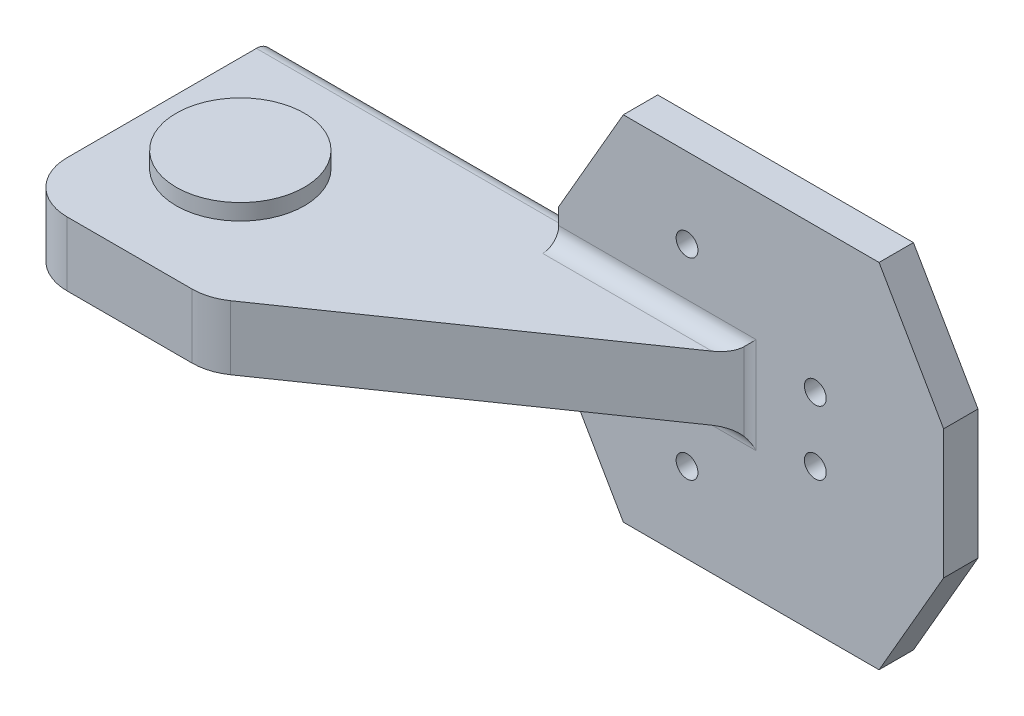
from build123d import *

# Parameters (mm, degrees)
BOSS_EXTRUDE1_DEPTH = 12.7
BOSS_EXTRUDE2_DEPTH = 6.805909
SKETCH3_R           = 2.159
CUT_EXTRUDE1_DEPTH  = 155.273638788
SKETCH5_R           = 2.159
CUT_EXTRUDE2_DEPTH  = 6.805909488
FILLET1_R           = 3.175
SKETCH6_R           = 12.7
BOSS_EXTRUDE3_DEPTH = 3.175
FILLET2_R           = 10.16


with BuildPart() as part:
    # Sketch1 → Boss-Extrude1 (new body)
    with BuildSketch(Plane(origin=(0, 0, 0), x_dir=(1, 0, 0), z_dir=(0, 1, 0))):
        Polygon((0, 25.4), (38.1, 25.4), (101.6, 25.4), (101.6, 18.594090512), (38.1, -25.4), (0, -25.4), align=None)
    extrude(amount=BOSS_EXTRUDE1_DEPTH)

    # Sketch2 → Boss-Extrude2 (add)
    with BuildSketch(Plane(origin=(0, 0, -25.4), x_dir=(-1, 0, 0), z_dir=(0, 0, -1))):
        Polygon((-63.5, 19.133437227), (-63.5, -6.433437227), (-76.283437227, -28.575), (-126.916562773, -28.575), (-139.7, -6.433437227), (-139.7, 19.133437227), (-126.916562773, 41.275), (-76.283437227, 41.275), align=None)
    extrude(amount=-BOSS_EXTRUDE2_DEPTH)

    # Sketch3 → Cut-Extrude1 (cut, through all)
    with BuildSketch(Plane(origin=(0, 0, -25.4), x_dir=(-1, 0, 0), z_dir=(0, 0, -1))):
        with Locations((-88.9, 25.4)):
            Circle(SKETCH3_R)
        with Locations((-88.9, -12.7)):
            Circle(SKETCH3_R)
    extrude(amount=-CUT_EXTRUDE1_DEPTH, mode=Mode.SUBTRACT)

    # Sketch5 → Cut-Extrude2 (cut)
    with BuildSketch(Plane(origin=(0, 0, -25.4), x_dir=(-1, 0, 0), z_dir=(0, 0, -1))):
        with Locations((-114.3, 0)):
            Circle(SKETCH5_R)
        with Locations((-114.3, 12.7)):
            Circle(SKETCH5_R)
    extrude(amount=-CUT_EXTRUDE2_DEPTH, mode=Mode.SUBTRACT)

    # Fillet1
    fillet1_edges = [part.edges().sort_by_distance(p)[0] for p in [
        (101.6, 6.35, -18.594090512),
        (31.75, 0, -25.4),
        (82.55, 0, -18.594091),
        (31.75, 12.7, -25.4),
        (82.55, 12.7, -18.594091),
    ]]
    fillet(fillet1_edges, radius=FILLET1_R)

    # Sketch6 → Boss-Extrude3 (add)
    with BuildSketch(Plane(origin=(0, 12.7, 0), x_dir=(1, 0, 0), z_dir=(0, 1, 0))):
        with Locations(Location((19.05, 0, 0), (0, 0, 270))):
            Circle(SKETCH6_R)
    extrude(amount=BOSS_EXTRUDE3_DEPTH)

    # Fillet2
    fillet2_edges = [part.edges().sort_by_distance(p)[0] for p in [
        (38.1, 6.35, 25.4),
        (0, 6.35, 25.4),
    ]]
    fillet(fillet2_edges, radius=FILLET2_R)


solid = part.part
